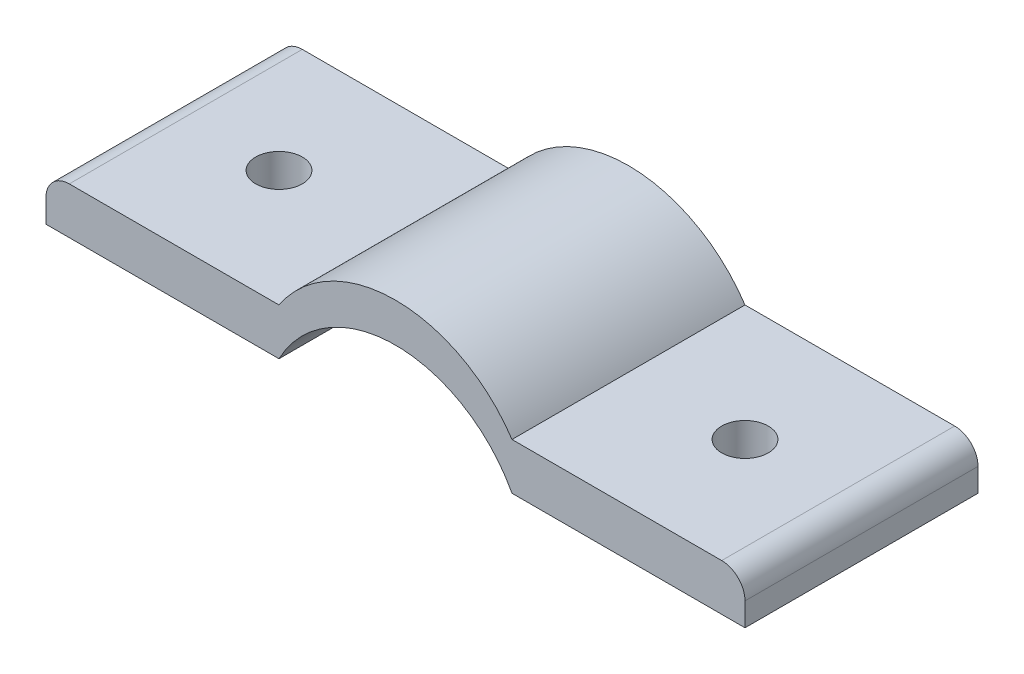
from build123d import *

# Parameters (mm, degrees)
BOSS_EXTRUDE1_DEPTH = 10
SKETCH2_R           = 1
CUT_EXTRUDE1_DEPTH  = 10
FILLET1_R           = 1


with BuildPart() as part:
    # Sketch1 → Boss-Extrude1 (new body)
    with BuildSketch(Plane.XY):
        with BuildLine():
            Line((-24.705882353, -2.573529412), (-14.705882353, -2.573529412))
            ThreePointArc((-14.705882353, -2.573529412), (-9.705882353, 0.434570501), (-4.705882353, -2.573529412))
            Line((-4.705882353, -2.573529412), (5.294117647, -2.573529412))
            Line((5.294117647, -2.573529412), (5.294117647, -0.573529412))
            Line((5.294117647, -0.573529412), (-4.705882353, -0.573529412))
            ThreePointArc((-4.705882353, -0.573529412), (-9.705882353, 2.106978403), (-14.705882353, -0.573529412))
            Line((-14.705882353, -0.573529412), (-24.705882353, -0.573529412))
            Line((-24.705882353, -0.573529412), (-24.705882353, -2.573529412))
        make_face()
    extrude(amount=BOSS_EXTRUDE1_DEPTH)

    # Sketch2 → Cut-Extrude1 (cut)
    with BuildSketch(Plane(origin=(0, -0.573529412, 0), x_dir=(1, 0, 0), z_dir=(0, 1, 0))):
        with Locations(Location((0.294117647, -5, 0), (0, 0, 270))):
            Circle(SKETCH2_R)
        with Locations(Location((-19.705882353, -5, 0), (0, 0, 270))):
            Circle(SKETCH2_R)
    extrude(amount=-CUT_EXTRUDE1_DEPTH, mode=Mode.SUBTRACT)

    # Fillet1
    fillet1_edges = [part.edges().sort_by_distance(p)[0] for p in [
        (-24.705882353, -0.573529412, 5),
        (5.294117647, -0.573529412, 5),
    ]]
    fillet(fillet1_edges, radius=FILLET1_R)


solid = part.part
